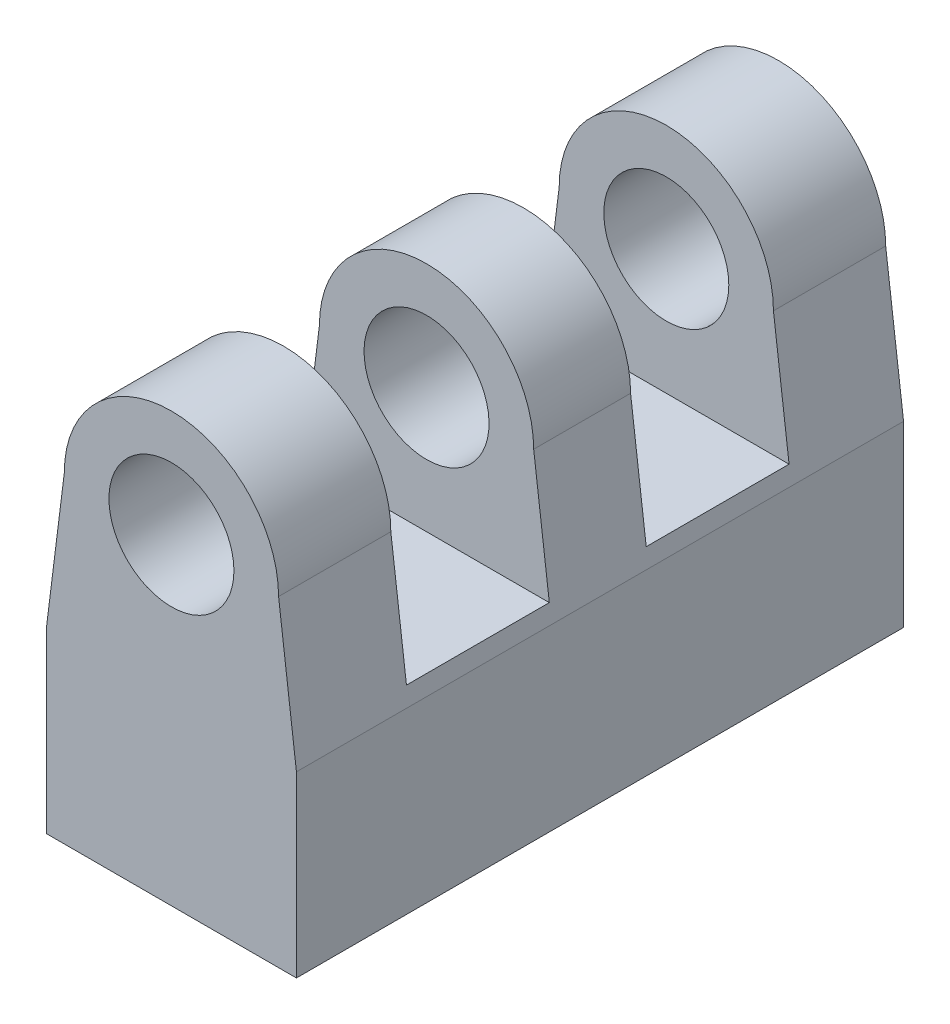
from build123d import *

# Parameters (mm, degrees)
SKETCH_1_R               = 3.5
EXTRUDE_2_DEPTH          = 34
CUT_EXTRUDE_1_DEPTH      = 42.388404173
CUT_EXTRUDE_1_DEPTH_BACK = 42.388404173
SKETCH_3_W               = 8
SKETCH_3_H               = 13
SKETCH_4_R               = 5.05
CUT_EXTRUDE_3_DEPTH      = 10


with BuildPart() as part:
    # 草图1 → 凸台-拉伸2 (new body)
    with BuildSketch(Plane.XY):
        with BuildLine():
            Line((7, 5), (7, -5))
            Line((7, -5), (-7, -5))
            Line((-7, -5), (-7, 5))
            Line((-7, 5), (-6, 13))
            ThreePointArc((-6, 13), (0, 19), (6, 13))
            Line((6, 13), (7, 5))
        make_face()
        with Locations((0, 13)):
            Circle(SKETCH_1_R, mode=Mode.SUBTRACT)
    extrude(amount=EXTRUDE_2_DEPTH)

    # 草图3 → 切除-拉伸1 (cut, two sides: drawn at the far end of the back side and taken through both)
    with BuildSketch(Plane(origin=(7, 0, 0), x_dir=(0, 0, -1), z_dir=(1, 0, 0)).offset(-CUT_EXTRUDE_1_DEPTH_BACK)):
        with Locations((-23.713626646, 12.5)):
            Rectangle(SKETCH_3_W, SKETCH_3_H)
        Polygon((-6.286373354, 19), (-13.713626646, 19), (-14.286373354, 19), (-14.286373354, 6), (-6.286373354, 6), align=None)
    extrude(amount=CUT_EXTRUDE_1_DEPTH + CUT_EXTRUDE_1_DEPTH_BACK, mode=Mode.SUBTRACT)

    # 草图4 → 切除-拉伸3 (cut)
    with BuildSketch(Plane.XZ.offset(5)):
        with Locations((-0.001873454, 27)):
            Circle(SKETCH_4_R)
        with Locations((-0.001873454, 7)):
            Circle(SKETCH_4_R)
    extrude(amount=-CUT_EXTRUDE_3_DEPTH, mode=Mode.SUBTRACT)


solid = part.part
